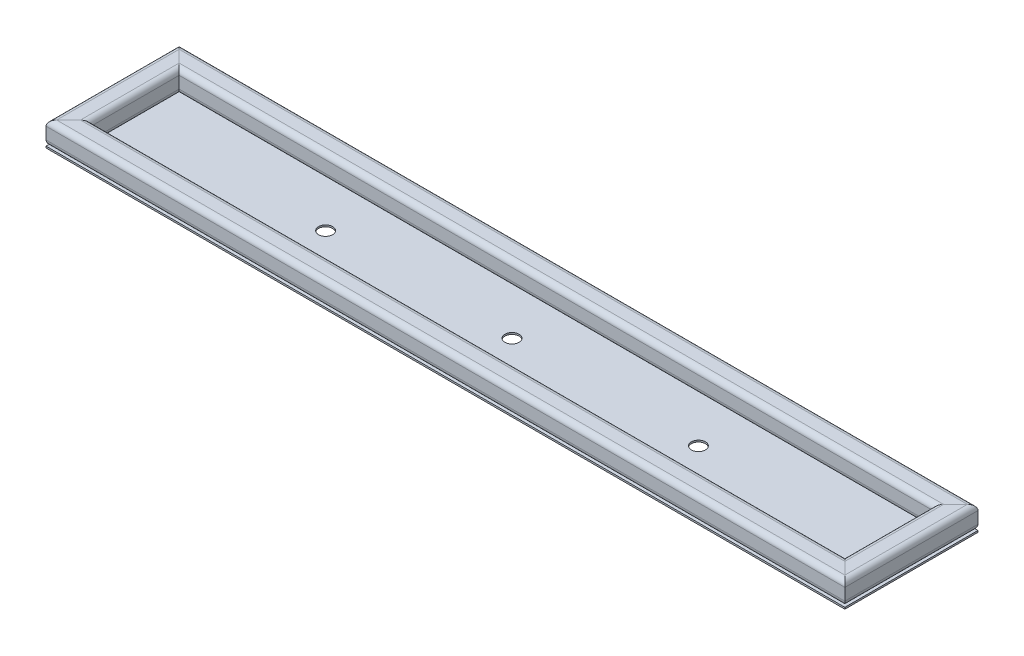
from build123d import *

# Parameters (mm, degrees)
TUBO_CUADRADO_2_X_2_X_0_25_1_DEPTH      = 186.921024484
TUBO_CUADRADO_2_X_2_X_0_25_1_DEPTH_BACK = 36.921024484
TUBO_CUADRADO_2_X_2_X_0_25_1_2_DEPTH    = 973.842048969
TUBO_CUADRADO_2_X_2_X_0_25_1_3_DEPTH    = 223.842048969
TUBO_CUADRADO_2_X_2_X_0_25_1_4_DEPTH    = 973.842048969
CROQUIS3_W                              = 900
CROQUIS3_H                              = 150
SALIENTE_EXTRUIR1_DEPTH                 = 1.9
CROQUIS4_R                              = 7.9375
CROQUIS4_R_2                            = 7.937500001
CORTAR_EXTRUIR1_DEPTH                   = 10


with BuildPart() as part:
    # Sketch1 → Tubo cuadrado 2 X 2 X 0.25(1) (new, two sides: drawn at the far end of the back side and taken through both)
    with BuildSketch(Plane(origin=(-437.3, 12.7, -75), x_dir=(1, 0, 0), z_dir=(0, 0, 1)).offset(-TUBO_CUADRADO_2_X_2_X_0_25_1_DEPTH_BACK)):
        with BuildLine():
            Line((-6.7, -12.7), (6.7, -12.7))
            ThreePointArc((6.7, -12.7), (10.942640687, -10.942640687), (12.7, -6.7))
            Line((12.7, -6.7), (12.7, 6.7))
            ThreePointArc((12.7, 6.7), (10.942640687, 10.942640687), (6.7, 12.7))
            Line((6.7, 12.7), (-6.7, 12.7))
            ThreePointArc((-6.7, 12.7), (-10.942640687, 10.942640687), (-12.7, 6.7))
            Line((-12.7, 6.7), (-12.7, -6.7))
            ThreePointArc((-12.7, -6.7), (-10.942640687, -10.942640687), (-6.7, -12.7))
        make_face()
        with BuildLine():
            Line((-6.7, -9.7), (6.7, -9.7))
            ThreePointArc((6.7, -9.7), (8.821320344, -8.821320344), (9.7, -6.7))
            Line((9.7, -6.7), (9.7, 6.7))
            ThreePointArc((9.7, 6.7), (8.821320344, 8.821320344), (6.7, 9.7))
            Line((6.7, 9.7), (-6.7, 9.7))
            ThreePointArc((-6.7, 9.7), (-8.821320344, 8.821320344), (-9.7, 6.7))
            Line((-9.7, 6.7), (-9.7, -6.7))
            ThreePointArc((-9.7, -6.7), (-8.821320344, -8.821320344), (-6.7, -9.7))
        make_face(mode=Mode.SUBTRACT)
    extrude(amount=TUBO_CUADRADO_2_X_2_X_0_25_1_DEPTH + TUBO_CUADRADO_2_X_2_X_0_25_1_DEPTH_BACK)

    # Tubo cuadrado 2 X 2 X 0.25(1) mitre 1
    split(bisect_by=Plane(origin=(-450, 0, -75), x_dir=(0, -1, 0), z_dir=(-0.707106781, 0, 0.707106781)), keep=Keep.TOP)

    # Tubo cuadrado 2 X 2 X 0.25(1) mitre 2
    split(bisect_by=Plane(origin=(-450, 0, 75), x_dir=(0, -1, 0), z_dir=(-0.707106781, 0, -0.707106781)), keep=Keep.TOP)


with BuildPart() as body_2:
    # Sketch1 on segment 2 (carried to segment 2) → Tubo cuadrado 2 X 2 X 0.25_1 2 (new body)
    with BuildSketch(Plane(origin=(-486.921024484, 12.7, 62.3), x_dir=(0, 0, -1), z_dir=(1, 0, 0))):
        with BuildLine():
            Line((-6.7, -12.7), (6.7, -12.7))
            ThreePointArc((6.7, -12.7), (10.942640687, -10.942640687), (12.7, -6.7))
            Line((12.7, -6.7), (12.7, 6.7))
            ThreePointArc((12.7, 6.7), (10.942640687, 10.942640687), (6.7, 12.7))
            Line((6.7, 12.7), (-6.7, 12.7))
            ThreePointArc((-6.7, 12.7), (-10.942640687, 10.942640687), (-12.7, 6.7))
            Line((-12.7, 6.7), (-12.7, -6.7))
            ThreePointArc((-12.7, -6.7), (-10.942640687, -10.942640687), (-6.7, -12.7))
        make_face()
        with BuildLine():
            Line((-6.7, -9.7), (6.7, -9.7))
            ThreePointArc((6.7, -9.7), (8.821320344, -8.821320344), (9.7, -6.7))
            Line((9.7, -6.7), (9.7, 6.7))
            ThreePointArc((9.7, 6.7), (8.821320344, 8.821320344), (6.7, 9.7))
            Line((6.7, 9.7), (-6.7, 9.7))
            ThreePointArc((-6.7, 9.7), (-8.821320344, 8.821320344), (-9.7, 6.7))
            Line((-9.7, 6.7), (-9.7, -6.7))
            ThreePointArc((-9.7, -6.7), (-8.821320344, -8.821320344), (-6.7, -9.7))
        make_face(mode=Mode.SUBTRACT)
    extrude(amount=TUBO_CUADRADO_2_X_2_X_0_25_1_2_DEPTH)

    # Tubo cuadrado 2 X 2 X 0.25_1 2 mitre 1
    split(bisect_by=Plane(origin=(-450, 0, 75), x_dir=(0, 1, 0), z_dir=(0.707106781, 0, 0.707106781)), keep=Keep.TOP)

    # Tubo cuadrado 2 X 2 X 0.25_1 2 mitre 2
    split(bisect_by=Plane(origin=(450, 0, 75), x_dir=(0, -1, 0), z_dir=(-0.707106781, 0, 0.707106781)), keep=Keep.TOP)


with BuildPart() as body_3:
    # Sketch1 on segment 3 (carried to segment 3) → Tubo cuadrado 2 X 2 X 0.25_1 3 (new body)
    with BuildSketch(Plane(origin=(437.3, 12.7, 111.921024484), x_dir=(-1, 0, 0), z_dir=(0, 0, -1))):
        with BuildLine():
            Line((-6.7, -12.7), (6.7, -12.7))
            ThreePointArc((6.7, -12.7), (10.942640687, -10.942640687), (12.7, -6.7))
            Line((12.7, -6.7), (12.7, 6.7))
            ThreePointArc((12.7, 6.7), (10.942640687, 10.942640687), (6.7, 12.7))
            Line((6.7, 12.7), (-6.7, 12.7))
            ThreePointArc((-6.7, 12.7), (-10.942640687, 10.942640687), (-12.7, 6.7))
            Line((-12.7, 6.7), (-12.7, -6.7))
            ThreePointArc((-12.7, -6.7), (-10.942640687, -10.942640687), (-6.7, -12.7))
        make_face()
        with BuildLine():
            Line((-6.7, -9.7), (6.7, -9.7))
            ThreePointArc((6.7, -9.7), (8.821320344, -8.821320344), (9.7, -6.7))
            Line((9.7, -6.7), (9.7, 6.7))
            ThreePointArc((9.7, 6.7), (8.821320344, 8.821320344), (6.7, 9.7))
            Line((6.7, 9.7), (-6.7, 9.7))
            ThreePointArc((-6.7, 9.7), (-8.821320344, 8.821320344), (-9.7, 6.7))
            Line((-9.7, 6.7), (-9.7, -6.7))
            ThreePointArc((-9.7, -6.7), (-8.821320344, -8.821320344), (-6.7, -9.7))
        make_face(mode=Mode.SUBTRACT)
    extrude(amount=TUBO_CUADRADO_2_X_2_X_0_25_1_3_DEPTH)

    # Tubo cuadrado 2 X 2 X 0.25_1 3 mitre 1
    split(bisect_by=Plane(origin=(450, 0, -75), x_dir=(0, 1, 0), z_dir=(0.707106781, 0, 0.707106781)), keep=Keep.TOP)

    # Tubo cuadrado 2 X 2 X 0.25_1 3 mitre 2
    split(bisect_by=Plane(origin=(450, 0, 75), x_dir=(0, 1, 0), z_dir=(0.707106781, 0, -0.707106781)), keep=Keep.TOP)


with BuildPart() as body_4:
    # Sketch1 on segment 4 (carried to segment 4) → Tubo cuadrado 2 X 2 X 0.25_1 4 (new body)
    with BuildSketch(Plane(origin=(486.921024484, 12.7, -62.3), x_dir=(0, 0, 1), z_dir=(-1, 0, 0))):
        with BuildLine():
            Line((-6.7, -12.7), (6.7, -12.7))
            ThreePointArc((6.7, -12.7), (10.942640687, -10.942640687), (12.7, -6.7))
            Line((12.7, -6.7), (12.7, 6.7))
            ThreePointArc((12.7, 6.7), (10.942640687, 10.942640687), (6.7, 12.7))
            Line((6.7, 12.7), (-6.7, 12.7))
            ThreePointArc((-6.7, 12.7), (-10.942640687, 10.942640687), (-12.7, 6.7))
            Line((-12.7, 6.7), (-12.7, -6.7))
            ThreePointArc((-12.7, -6.7), (-10.942640687, -10.942640687), (-6.7, -12.7))
        make_face()
        with BuildLine():
            Line((-6.7, -9.7), (6.7, -9.7))
            ThreePointArc((6.7, -9.7), (8.821320344, -8.821320344), (9.7, -6.7))
            Line((9.7, -6.7), (9.7, 6.7))
            ThreePointArc((9.7, 6.7), (8.821320344, 8.821320344), (6.7, 9.7))
            Line((6.7, 9.7), (-6.7, 9.7))
            ThreePointArc((-6.7, 9.7), (-8.821320344, 8.821320344), (-9.7, 6.7))
            Line((-9.7, 6.7), (-9.7, -6.7))
            ThreePointArc((-9.7, -6.7), (-8.821320344, -8.821320344), (-6.7, -9.7))
        make_face(mode=Mode.SUBTRACT)
    extrude(amount=TUBO_CUADRADO_2_X_2_X_0_25_1_4_DEPTH)

    # Tubo cuadrado 2 X 2 X 0.25_1 4 mitre 1
    split(bisect_by=Plane(origin=(-450, 0, -75), x_dir=(0, 1, 0), z_dir=(0.707106781, 0, -0.707106781)), keep=Keep.TOP)

    # Tubo cuadrado 2 X 2 X 0.25_1 4 mitre 2
    split(bisect_by=Plane(origin=(450, 0, -75), x_dir=(0, -1, 0), z_dir=(-0.707106781, 0, -0.707106781)), keep=Keep.TOP)


with BuildPart() as body_5:
    # Croquis3 → Saliente-Extruir1 (new body)
    with BuildSketch(Plane.XZ):
        Rectangle(CROQUIS3_W, CROQUIS3_H)
    extrude(amount=SALIENTE_EXTRUIR1_DEPTH)

    # Croquis4 → Cortar-Extruir1 (cut)
    with BuildSketch(Plane(origin=(0, 0, 0), x_dir=(1, 0, 0), z_dir=(0, 1, 0))):
        with Locations(Location((-209.999999999, 1e-09, 0), (0, 0, 180))):
            Circle(CROQUIS4_R)
        with Locations(Location((0, 0, 0), (0, 0, 180))):
            Circle(CROQUIS4_R_2)
        with Locations(Location((210.000000001, 0.002204667, 0), (0, 0, 180))):
            Circle(CROQUIS4_R)
    extrude(amount=-CORTAR_EXTRUIR1_DEPTH, mode=Mode.SUBTRACT)


solid = Compound([part.part, body_2.part, body_3.part, body_4.part, body_5.part])
